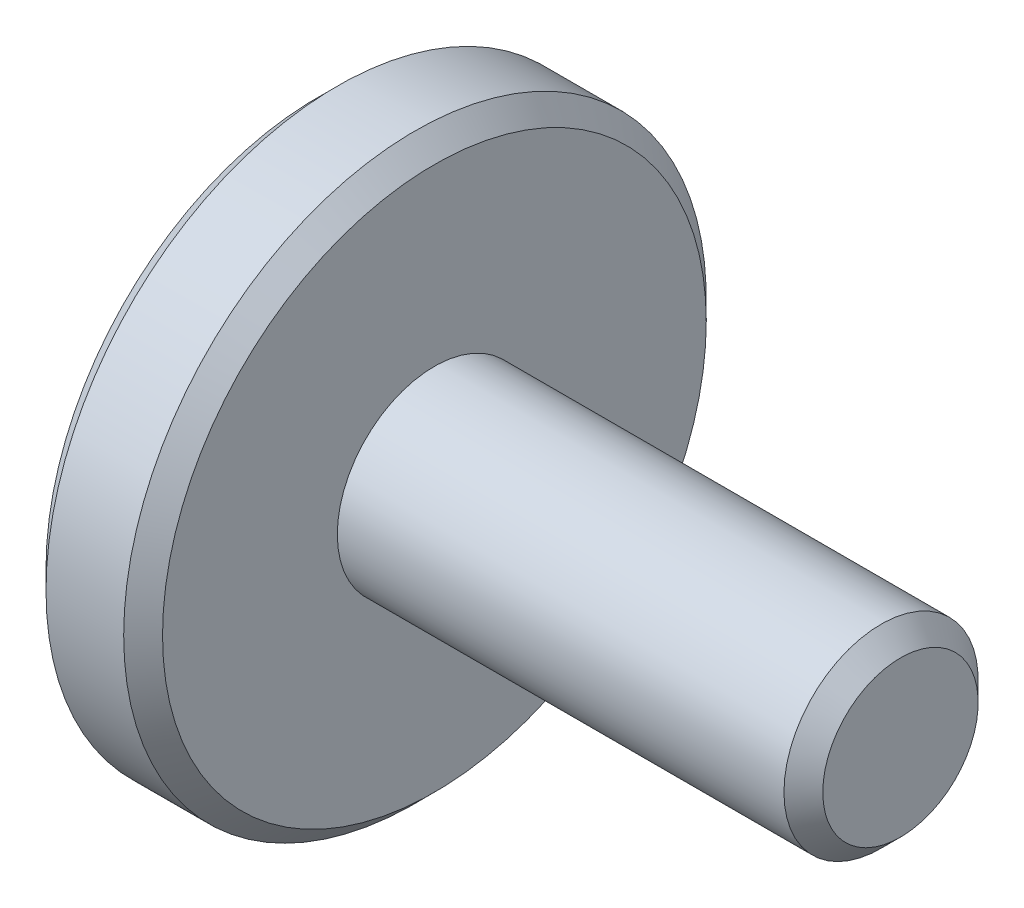
from build123d import *

# Parameters (mm, degrees)
CHANFREIN1_SIZE = 0.5


with BuildPart() as part:
    # Esquisse1 → Révolution1 (revolve)
    with BuildSketch(Plane.XY, mode=Mode.PRIVATE) as r_volution1_sk:
        Polygon((0, 0), (0, 7.5), (3, 7.5), (3, 2.5), (15, 2.5), (15, 0), align=None)
    revolve(r_volution1_sk.sketch.rotate(Axis((-65.170410524, 0, 0), (1, 0, 0)), 90), axis=Axis((-65.170410524, 0, 0), (1, 0, 0)))

    # Chanfrein1
    chanfrein1_edges = [part.edges().sort_by_distance(p)[0] for p in [
        (15, 0, -2.5),
        (3, 0, -7.5),
        (0, 0, -7.5),
    ]]
    chamfer(chanfrein1_edges, length=CHANFREIN1_SIZE)


solid = part.part
